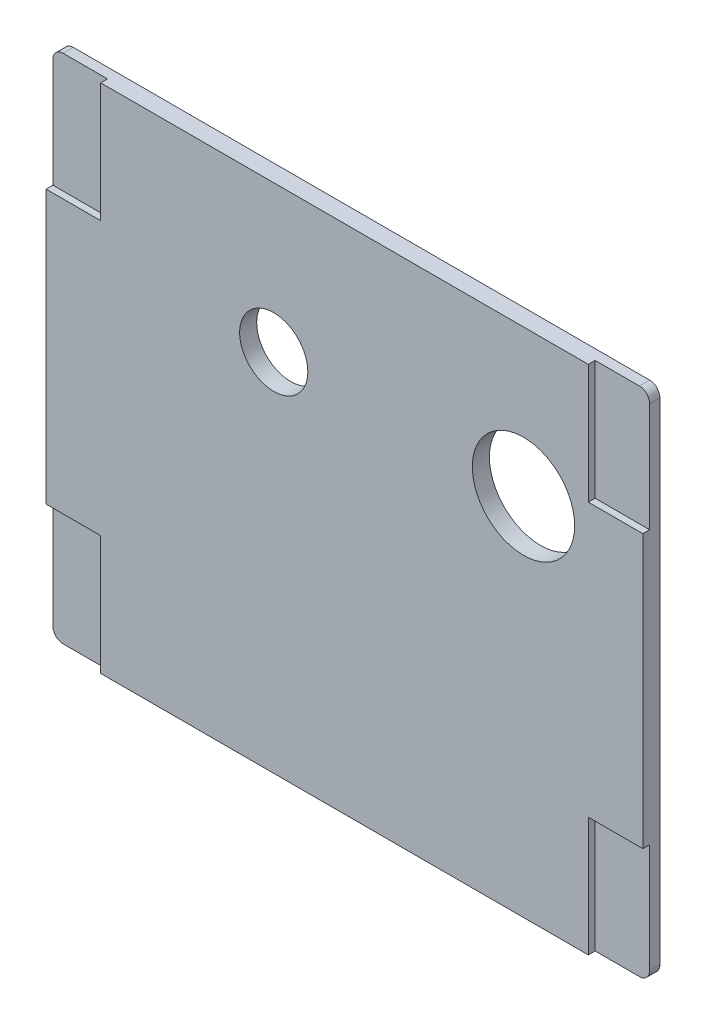
from build123d import *

# Parameters (mm, degrees)
SKETCH1_W           = 175
SKETCH1_H           = 150
BOSS_EXTRUDE1_DEPTH = 5
SKETCH3_R           = 15
SKETCH3_R_2         = 10
CUT_EXTRUDE1_DEPTH  = 5
SKETCH4_W           = 16
SKETCH4_H           = 35
CUT_EXTRUDE2_DEPTH  = 2
FILLET1_R           = 3


with BuildPart() as part:
    # Sketch1 → Boss-Extrude1 (new body)
    with BuildSketch(Plane.XY):
        with Locations((-87.5, -75)):
            Rectangle(SKETCH1_W, SKETCH1_H)
    extrude(amount=BOSS_EXTRUDE1_DEPTH)

    # Sketch3 → Cut-Extrude1 (cut)
    with BuildSketch(Plane.XY.offset(5)):
        with Locations((-35, -43)):
            Circle(SKETCH3_R)
        with Locations((-108.25, -43)):
            Circle(SKETCH3_R_2)
    extrude(amount=-CUT_EXTRUDE1_DEPTH, mode=Mode.SUBTRACT)

    # Sketch4 → Cut-Extrude2 (cut)
    with BuildSketch(Plane.XY.offset(5)):
        with Locations((-167, -17.5)):
            Rectangle(SKETCH4_W, SKETCH4_H)
        with Locations((-8, -17.5)):
            Rectangle(SKETCH4_W, SKETCH4_H)
        with Locations((-8, -132.5)):
            Rectangle(SKETCH4_W, SKETCH4_H)
        with Locations((-167, -132.5)):
            Rectangle(SKETCH4_W, SKETCH4_H)
    extrude(amount=-CUT_EXTRUDE2_DEPTH, mode=Mode.SUBTRACT)

    # Fillet1
    fillet1_edges = [part.edges().sort_by_distance(p)[0] for p in [
        (0, -150, 1.5),
        (-175, -150, 1.5),
        (-175, 0, 1.5),
        (0, 0, 1.5),
    ]]
    fillet(fillet1_edges, radius=FILLET1_R)


solid = part.part
